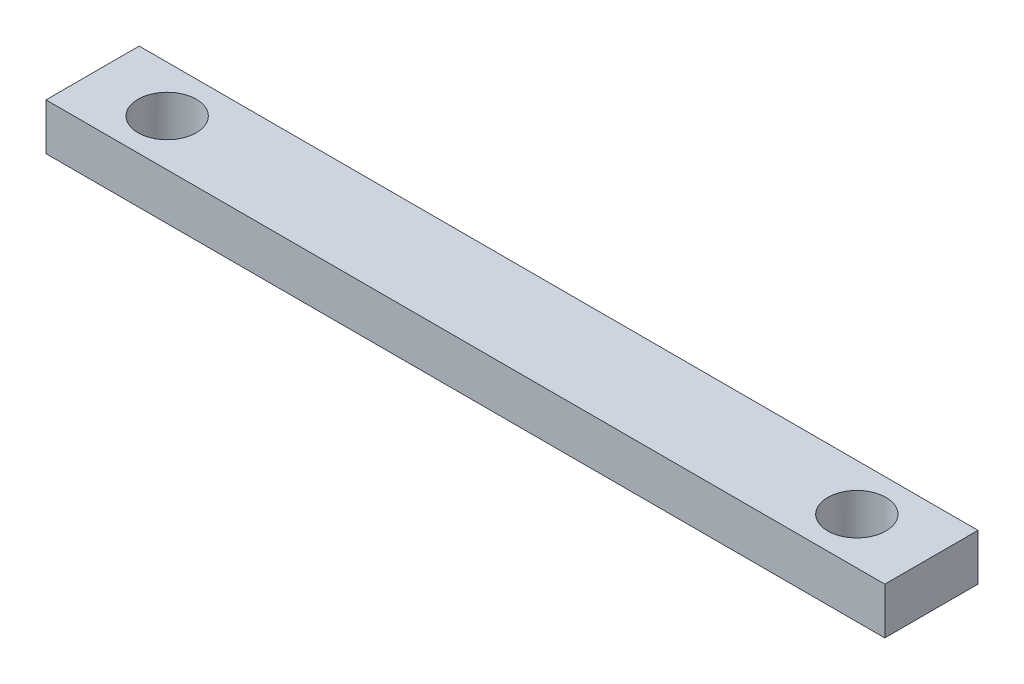
from build123d import *

# Parameters (mm, degrees)
SKETCH1_W                          = 114.3
SKETCH1_H                          = 12.7
BOSS_EXTRUDE1_DEPTH                = 6.35
F_5_16_0_3125_DIAMETER_HOLE1_D     = 7.9375
F_5_16_0_3125_DIAMETER_HOLE1_DEPTH = 14.986
F_5_16_0_3125_DIAMETER_HOLE1_TIP   = 2.384665582


with BuildPart() as part:
    # Sketch1 → Boss-Extrude1 (new body)
    with BuildSketch(Plane(origin=(0, 0, 0), x_dir=(1, 0, 0), z_dir=(0, 1, 0))):
        Rectangle(SKETCH1_W, SKETCH1_H)
    extrude(amount=BOSS_EXTRUDE1_DEPTH)

    # 5/16 (0.3125) Diameter Hole1
    with Locations(Plane(origin=(0, 6.35, 0), x_dir=(1, 0, 0), z_dir=(0, 1, 0))):
        with Locations((-46.99, 0), (46.99, 0)):
            Hole(F_5_16_0_3125_DIAMETER_HOLE1_D / 2, depth=F_5_16_0_3125_DIAMETER_HOLE1_DEPTH)
            with Locations((0, 0, -(F_5_16_0_3125_DIAMETER_HOLE1_DEPTH + F_5_16_0_3125_DIAMETER_HOLE1_TIP / 2))):  # 118° drill point
                Cone(0, F_5_16_0_3125_DIAMETER_HOLE1_D / 2, F_5_16_0_3125_DIAMETER_HOLE1_TIP, mode=Mode.SUBTRACT)


solid = part.part
